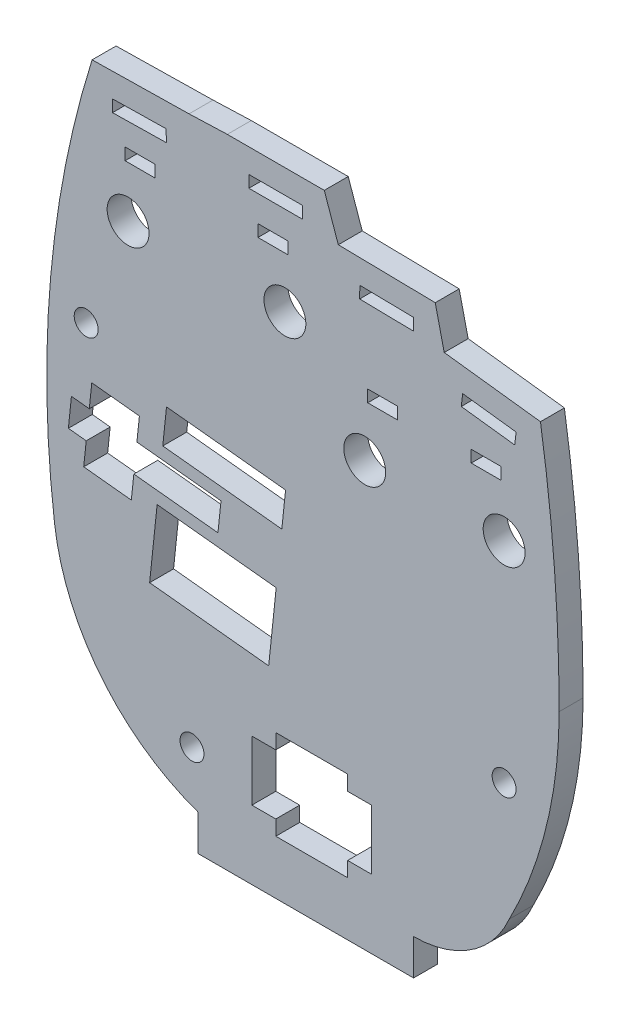
from build123d import *

# Parameters (mm, degrees)
SKETCH1_R           = 2
SKETCH1_R_2         = 3.5
SKETCH1_W           = 9
SKETCH1_H           = 2
SKETCH1_W_2         = 5
BOSS_EXTRUDE1_DEPTH = 4


with BuildPart() as part:
    # Sketch1 → Boss-Extrude1 (new body)
    with BuildSketch(Plane.XY):
        with BuildLine():
            Line((-12.978640908, -18), (-12.978640908, -24))
            Line((-12.978640908, -24), (23.021359092, -24))
            Line((23.021359092, -24), (23.021359092, -18))
            ThreePointArc((23.021359092, -18), (32.58126188, -15.140073441), (39, -7.5))
            ThreePointArc((39, -7.5), (45.227131985, 9.097629123), (47.343034567, 26.698237678))
            ThreePointArc((47.343034567, 26.698237678), (46.561018226, 46.955835458), (44.219623828, 67.092858318))
            Line((44.219623828, 67.092858318), (28.140376172, 69.067141682))
            Line((28.140376172, 69.067141682), (26.638766331, 75.523635508))
            Line((26.638766331, 75.523635508), (10.441233669, 75.806364492))
            Line((10.441233669, 75.806364492), (8.1, 82.51))
            Line((8.1, 82.51), (-8.1, 82.51))
            Line((-8.1, 82.51), (-14.491217975, 82.280462515))
            Line((-14.491217975, 82.280462515), (-30.688782025, 81.999537485))
            ThreePointArc((-30.688782025, 81.999537485), (-37.609553588, 47.248902923), (-36.96836533, 11.821617405))
            ThreePointArc((-36.96836533, 11.821617405), (-29.196719191, -6.486518424), (-12.978640908, -18))
        make_face()
        with Locations((38.147341743, 11.821617405)):
            Circle(SKETCH1_R, mode=Mode.SUBTRACT)
        with Locations((-24.678960076, 61.651218734)):
            Circle(SKETCH1_R_2, mode=Mode.SUBTRACT)
        with Locations((1.521420673, 61.651218734)):
            Circle(SKETCH1_R_2, mode=Mode.SUBTRACT)
        with Locations((14.86306514, 46.821617405)):
            Circle(SKETCH1_R_2, mode=Mode.SUBTRACT)
        with Locations((38.147341743, 46.821617405)):
            Circle(SKETCH1_R_2, mode=Mode.SUBTRACT)
        with Locations((-31.681501662, 43.456405989)):
            Circle(SKETCH1_R, mode=Mode.SUBTRACT)
        with Locations((-14, -9.124358763)):
            Circle(SKETCH1_R, mode=Mode.SUBTRACT)
        with Locations((0, 77.51)):
            Rectangle(SKETCH1_W, SKETCH1_H, mode=Mode.SUBTRACT)
        Polygon((-4, -2.5), (0, -2.5), (0, 0), (12, 0), (12, -2.5), (16, -2.5), (16, -12.5), (12, -12.5), (12, -15), (0, -15), (0, -12.5), (-4, -12.5), align=None, mode=Mode.SUBTRACT)
        with Locations((35.147341743, 56.321617405)):
            Rectangle(SKETCH1_W_2, SKETCH1_H, mode=Mode.SUBTRACT)
        Polygon((-27.318093916, 78.057395991), (-18.319447222, 78.213465452), (-18.284765119, 76.213766187), (-27.283411813, 76.057696726), align=None, mode=Mode.SUBTRACT)
        with Locations((17.86306514, 56.399848624)):
            Rectangle(SKETCH1_W_2, SKETCH1_H, mode=Mode.SUBTRACT)
        with Locations((-0.478579327, 71.151218734)):
            Rectangle(SKETCH1_W_2, SKETCH1_H, mode=Mode.SUBTRACT)
        Polygon((14.041615104, 71.742910288), (14.006710291, 69.743214898), (23.005339548, 69.58614324), (23.040244361, 71.58583863), align=None, mode=Mode.SUBTRACT)
        Polygon((40.158980309, 63.561403348), (31.226064944, 64.658227439), (30.982326257, 62.673135135), (39.915241622, 61.576311045), align=None, mode=Mode.SUBTRACT)
        Polygon((1.632632483, 35.912105076), (1.005748572, 29.944943559), (-18.884789816, 32.034556594), (-18.257905905, 38.00171811), align=None, mode=Mode.SUBTRACT)
        with Locations((-22.678960076, 71.151218734)):
            Rectangle(SKETCH1_W_2, SKETCH1_H, mode=Mode.SUBTRACT)
        Polygon((0.065422707, 20.994201285), (-1.188345114, 9.059878252), (-21.078883502, 11.149491286), (-19.825115681, 23.083814319), align=None, mode=Mode.SUBTRACT)
        Polygon((-9.666, 24.072796069), (-9.153, 28.955923243), (-23.205665371, 30.432234852), (-22.787742764, 34.410342529), (-30.743958119, 35.246187743), (-31.161880726, 31.268080066), (-34.143965433, 31.581364852), (-34.656965433, 26.698237678), (-31.674880726, 26.384952891), (-32.092803333, 22.406845214), (-24.136587978, 21.571), (-23.718665371, 25.549107678), align=None, mode=Mode.SUBTRACT)
    extrude(amount=BOSS_EXTRUDE1_DEPTH)


solid = part.part
